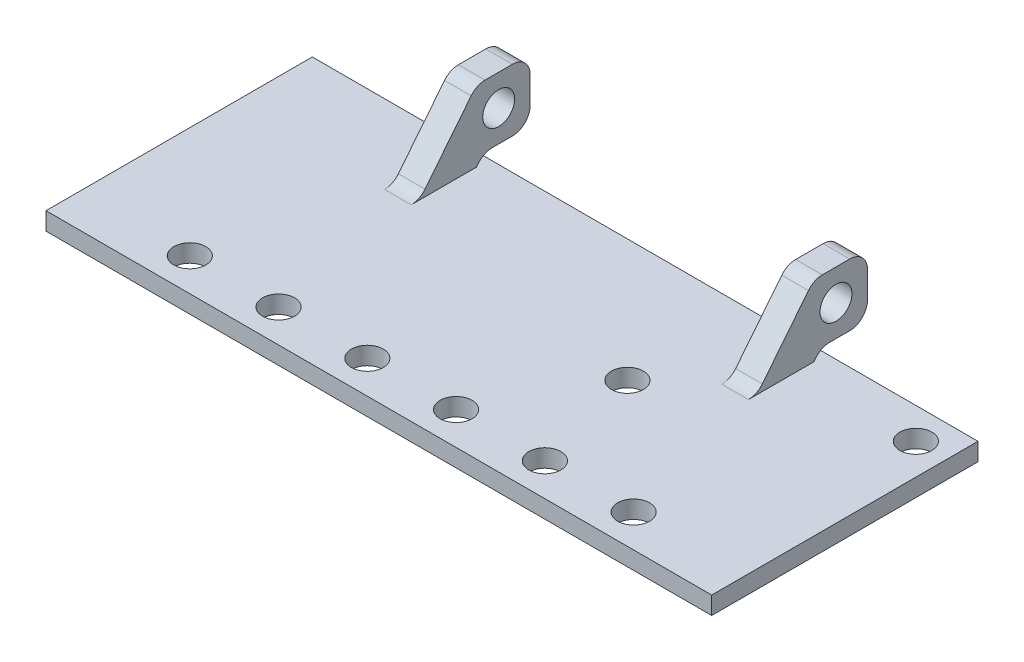
from build123d import *

# Parameters (mm, degrees)
SKETCH1_W            = 75
SKETCH1_H            = 30
BOSS_EXTRUDE1_DEPTH  = 2
M3_CLEARANCE_HOLE1_D = 3.6
SKETCH4_R            = 1.75
BOSS_EXTRUDE2_DEPTH  = 3
BOSS_EXTRUDE3_START  = -38
SKETCH4_2_R          = 1.75
BOSS_EXTRUDE3_DEPTH  = 3
FILLET1_R            = 2
M3_CLEARANCE_HOLE2_D = 3.6
M3_CLEARANCE_HOLE3_D = 3.6


with BuildPart() as part:
    # Sketch1 → Boss-Extrude1 (new body)
    with BuildSketch(Plane(origin=(0, 0, 0), x_dir=(1, 0, 0), z_dir=(0, 1, 0))):
        with Locations((37.5, 15)):
            Rectangle(SKETCH1_W, SKETCH1_H)
    extrude(amount=BOSS_EXTRUDE1_DEPTH)

    # M3 Clearance Hole1 (through all)
    with Locations(Plane(origin=(0, 2, 0), x_dir=(1, 0, 0), z_dir=(0, 1, 0))):
        with Locations((42.5, 3.7), (32.5, 3.7), (22.5, 3.7), (12.5, 3.7), (62.5, 3.7), (52.5, 3.7)):
            Hole(M3_CLEARANCE_HOLE1_D / 2)

    # Sketch4 → Boss-Extrude2 (add)
    # profile 1 of 2: a face of its own
    with BuildSketch(Plane.ZY.offset(-20)):
        with BuildLine():
            ThreePointArc((-29.462001252, 10.010018789), (-28.595073643, 9.812360744), (-27.899501252, 9.258455311))
            Line((-27.899501252, 9.258455311), (-22.1, 2))
            Line((-22.1, 2), (-28.5, 2))
            Line((-28.5, 2), (-28.706505632, 2.258455311))
            ThreePointArc((-28.706505632, 2.258455311), (-29.402078024, 2.812360744), (-30.269005632, 3.010018789))
            Line((-30.269005632, 3.010018789), (-32.55, 3.010018789))
            ThreePointArc((-32.55, 3.010018789), (-33.964213562, 3.595805227), (-34.55, 5.010018789))
            Line((-34.55, 5.010018789), (-34.55, 8.010018789))
            ThreePointArc((-34.55, 8.010018789), (-33.964213562, 9.424232352), (-32.55, 10.010018789))
            Line((-32.55, 10.010018789), (-29.462001252, 10.010018789))
        make_face()
        with Locations((-31, 6.510018789)):
            Circle(SKETCH4_R, mode=Mode.SUBTRACT)
    # profile 2 of 2: a face of its own
    with BuildSketch(Plane.ZY.offset(-20)):
        with Locations((-31, 6.510018789)):
            Circle(SKETCH4_R)
    extrude(amount=BOSS_EXTRUDE2_DEPTH)

    # Sketch4<2> → Boss-Extrude3 (add)
    # profile 1 of 2: a face of its own
    with BuildSketch(Plane.ZY.offset(-20).offset(BOSS_EXTRUDE3_START)):
        with BuildLine():
            ThreePointArc((-29.462001252, 10.010018789), (-28.595073643, 9.812360744), (-27.899501252, 9.258455311))
            Line((-27.899501252, 9.258455311), (-22.1, 2))
            Line((-22.1, 2), (-28.5, 2))
            Line((-28.5, 2), (-28.706505632, 2.258455311))
            ThreePointArc((-28.706505632, 2.258455311), (-29.402078024, 2.812360744), (-30.269005632, 3.010018789))
            Line((-30.269005632, 3.010018789), (-32.55, 3.010018789))
            ThreePointArc((-32.55, 3.010018789), (-33.964213562, 3.595805227), (-34.55, 5.010018789))
            Line((-34.55, 5.010018789), (-34.55, 8.010018789))
            ThreePointArc((-34.55, 8.010018789), (-33.964213562, 9.424232352), (-32.55, 10.010018789))
            Line((-32.55, 10.010018789), (-29.462001252, 10.010018789))
        make_face()
        with Locations((-31, 6.510018789)):
            Circle(SKETCH4_2_R, mode=Mode.SUBTRACT)
    # profile 2 of 2: a face of its own
    with BuildSketch(Plane.ZY.offset(-20).offset(BOSS_EXTRUDE3_START)):
        with Locations((-31, 6.510018789)):
            Circle(SKETCH4_2_R)
    extrude(amount=BOSS_EXTRUDE3_DEPTH)

    # Fillet1
    fillet1_edges = [part.edges().sort_by_distance(p)[0] for p in [
        (18.5, 2, -22.1),
        (56.5, 2, -22.1),
    ]]
    fillet(fillet1_edges, radius=FILLET1_R)

    # M3 Clearance Hole2 (through all)
    with Locations(Plane(origin=(58, 0, 0), x_dir=(0, 0, -1), z_dir=(1, 0, 0))):
        with Locations((31, 6.510018789)):
            Hole(M3_CLEARANCE_HOLE2_D / 2)

    # M3 Clearance Hole3 (through all)
    with Locations(Plane(origin=(0, 0, 0), x_dir=(-1, 0, 0), z_dir=(0, -1, 0))):
        with Locations((-49.3, 16.2), (-71.5, 26.5)):
            Hole(M3_CLEARANCE_HOLE3_D / 2)


solid = part.part
